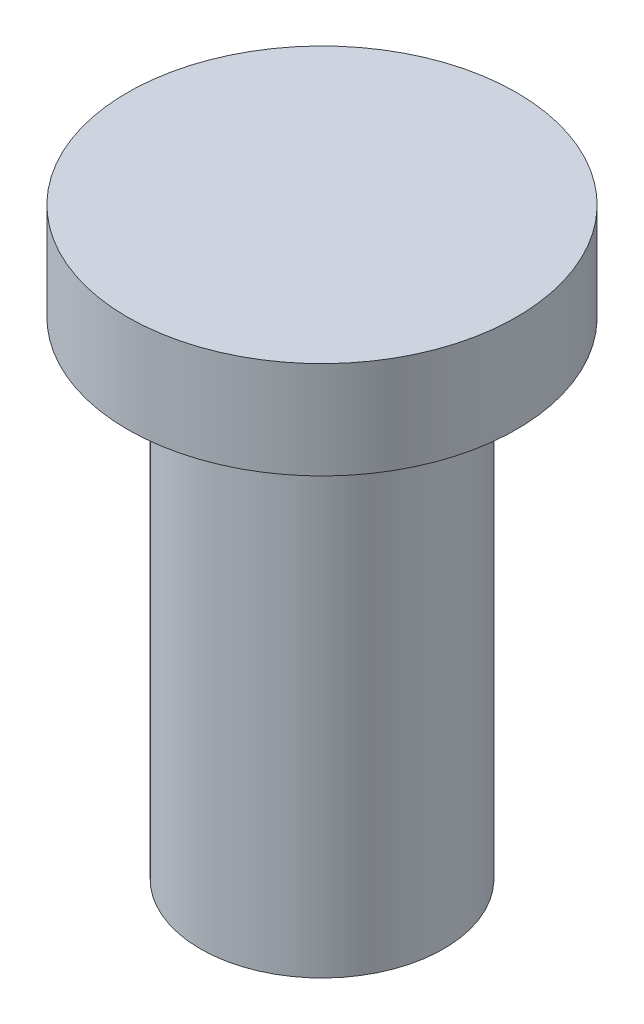
from build123d import *

# Parameters (mm, degrees)
SKETCH1_R           = 1.25
BOSS_EXTRUDE1_DEPTH = 5
SKETCH2_R           = 2
BOSS_EXTRUDE2_DEPTH = 1


with BuildPart() as part:
    # Sketch1 → Boss-Extrude1 (new body)
    with BuildSketch(Plane(origin=(0, 0, 0), x_dir=(1, 0, 0), z_dir=(0, 1, 0))):
        with Locations(Location((0, 0, 0), (0, 0, 270))):
            Circle(SKETCH1_R)
    extrude(amount=BOSS_EXTRUDE1_DEPTH)

    # Sketch2 → Boss-Extrude2 (add)
    with BuildSketch(Plane(origin=(0, 5, 0), x_dir=(1, 0, 0), z_dir=(0, 1, 0))):
        with Locations(Location((0, 0, 0), (0, 0, 270))):
            Circle(SKETCH2_R)
    extrude(amount=BOSS_EXTRUDE2_DEPTH)


solid = part.part
